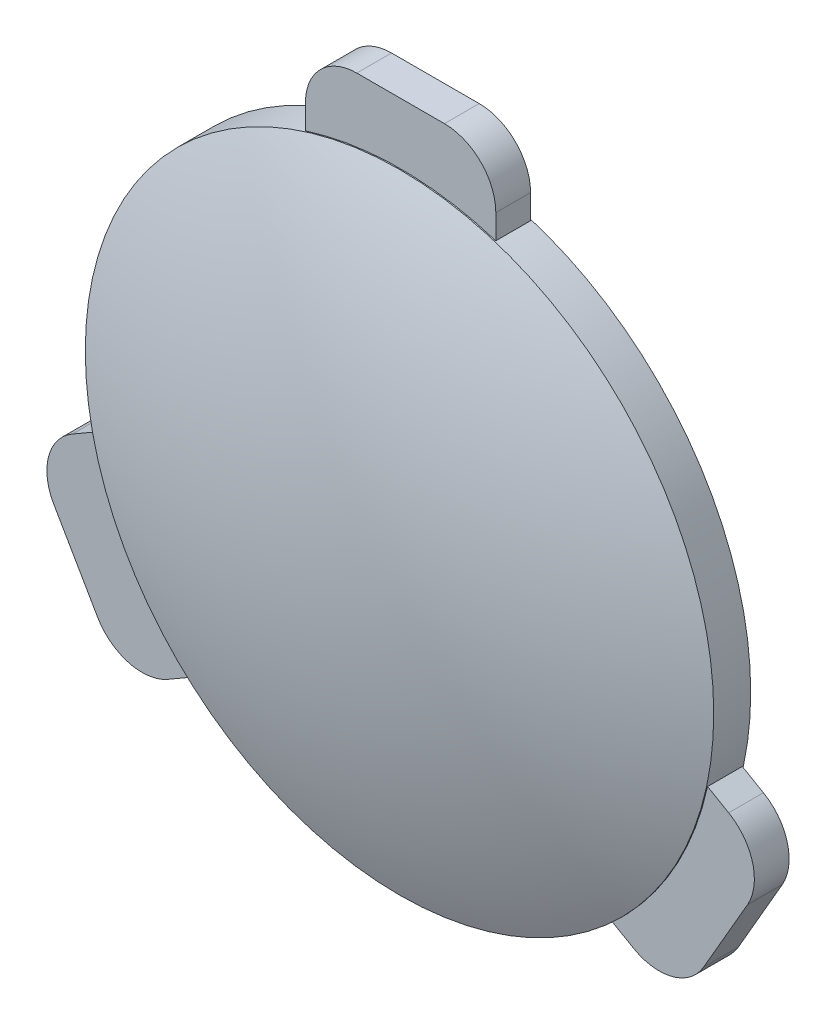
from build123d import *

# Parameters (mm, degrees)
BOSS_EXTRUDE1_DEPTH = 0.94
CIRPATTERN1_COUNT   = 3


with BuildPart() as part:
    # Sketch2 → Revolve1 (revolve)
    with BuildSketch(Plane(origin=(0, 0, 0), x_dir=(0, 0, -1), z_dir=(1, 0, 0))):
        with BuildLine():
            Line((-1, 17), (1, 17))
            ThreePointArc((1, 17), (3.49313133, 8.661985943), (4.334666688, 0))
            Line((4.334666688, 0), (-4.455333312, 0))
            ThreePointArc((-4.455333312, 0), (-3.58275786, 8.673801478), (-1, 17))
        make_face()
    revolve(axis=Axis((0, 0, 0), (0, 0, -1)))

    # Sketch3 → Boss-Extrude1 (add, symmetric)
    with BuildSketch(Plane.XY):
        with BuildLine():
            Line((-5.15, 16.201157366), (-5.15, 17.52))
            ThreePointArc((-5.15, 17.52), (-4.335756852, 19.485756852), (-2.37, 20.3))
            Line((-2.37, 20.3), (2.37, 20.3))
            ThreePointArc((2.37, 20.3), (4.335756852, 19.485756852), (5.15, 17.52))
            Line((5.15, 17.52), (5.15, 16.201157366))
            ThreePointArc((5.15, 16.201157366), (0, 17), (-5.15, 16.201157366))
        make_face()
    boss_extrude1 = extrude(amount=BOSS_EXTRUDE1_DEPTH, both=True)

    # CirPattern1: Boss-Extrude1 ×3 about axis
    cirpattern1_axis = Axis((0, 0, 0), (0, 0, 1))
    for i in range(1, CIRPATTERN1_COUNT):
        add(boss_extrude1.rotate(cirpattern1_axis, i * 360 / CIRPATTERN1_COUNT))


solid = part.part
